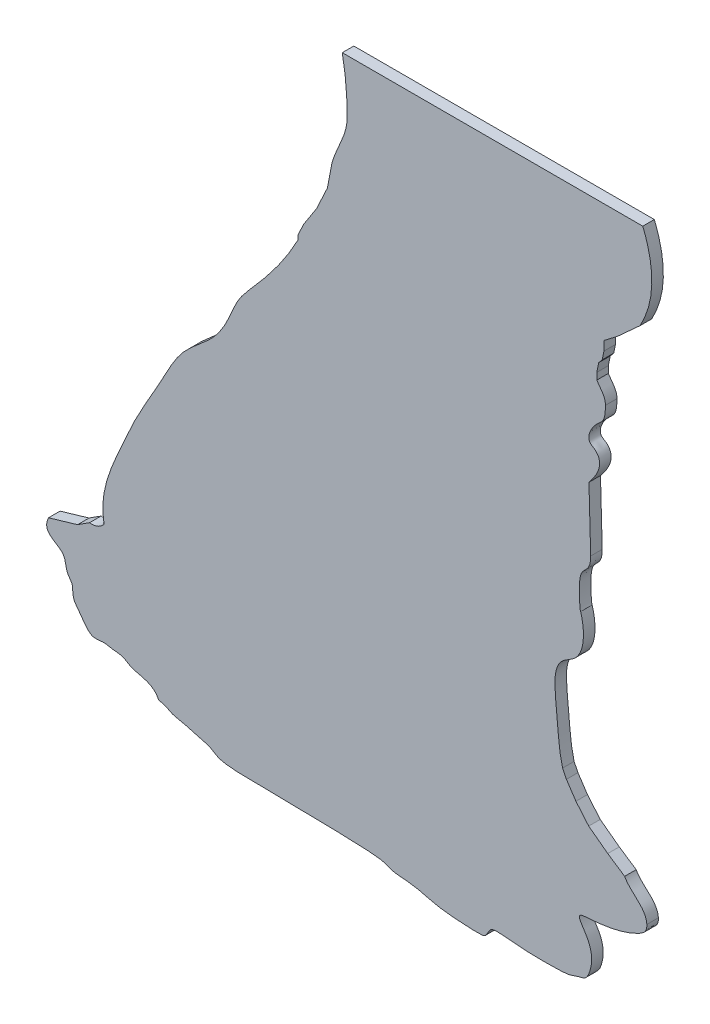
from build123d import *

# Parameters (mm, degrees)
BOSS_EXTRUDE2_DEPTH = 3.175


with BuildPart() as part:
    # Sketch1 → Boss-Extrude2 (new body)
    with BuildSketch(Plane.XY):
        with BuildLine():
            Line((167.202192931, 42.201207676), (162.551708352, 45.309526764))
            Line((162.551708352, 45.309526764), (157.314695785, 49.223337881))
            Line((157.314695785, 49.223337881), (153.792941224, 53.393644073))
            Line((153.792941224, 53.393644073), (151.178747268, 57.312700692))
            Line((151.178747268, 57.312700692), (150.112611404, 59.463302564))
            add(Edge.make_bspline(
                [(150.112611404, 59.463302564), (148.956776361, 63.836980097), (148.948583694, 71.439405876), (146.850507307, 84.051422667), (156.469353715, 88.150203705), (156.247504434, 95.51023866), (155.085269681, 99.2555556)],
                knots=[0, 0, 0, 0, 0.30878338, 0.618237109, 0.70440559, 1, 1, 1, 1], degree=3))
            add(Edge.make_bspline(
                [(157.85398611, 113.880538491), (157.856396998, 113.869859914), (157.850620297, 110.688002063), (155.308060719, 109.384630599), (154.418838948, 105.053269567), (154.8695522, 99.483416676), (155.085269681, 99.2555556)],
                knots=[0, 0, 0, 0, 0.124798805, 0.365607846, 0.555267038, 1, 1, 1, 1], degree=3))
            Line((157.85398611, 113.880538491), (157.37548461, 131.229540091))
            add(Edge.make_bspline(
                [(161.892659898, 151.807216677), (161.91251897, 149.031337188), (161.449944322, 147.791607901), (158.445100345, 145.385958906), (156.130886371, 141.380315264), (158.830222147, 140.043511959), (161.648730322, 137.407909117), (159.459654716, 133.727674066), (157.37548461, 131.229540091)],
                knots=[0, 0, 0, 0, 0.190659477, 0.228612673, 0.488802546, 0.534056192, 0.585175937, 1, 1, 1, 1], degree=3))
            add(Edge.make_bspline(
                [(159.534362736, 156.659486678), (160.786697559, 154.839870961), (162.005548182, 153.612430632), (161.892659898, 151.807216677)],
                knots=[0, 0, 0, 0, 1, 1, 1, 1], degree=3))
            Line((159.534362736, 156.659486678), (159.534362736, 158.498026385))
            Line((159.534362736, 158.498026385), (160.082455849, 161.112276627))
            Line((160.082455849, 161.112276627), (161.024283069, 162.24246929))
            Line((161.024283069, 162.24246929), (161.51276424, 164.572387305))
            Line((161.51276424, 164.572387305), (161.51276424, 167.102297744))
            Line((161.51276424, 167.102297744), (165.183542032, 169.901250177))
            Line((165.183542032, 169.901250177), (171.472031107, 175.621746691))
            add(Edge.make_bspline(
                [(172.196352762, 199.687728108), (177.512545782, 186.611864968), (171.472031107, 175.621746691)],
                knots=[0, 0, 0, 1, 1, 1], degree=2))
            Line((172.196352762, 199.687728108), (89.47301913, 199.687728108))
            add(Edge.make_bspline(
                [(89.47301913, 199.687728108), (90.449698127, 194.83749072), (90.825955315, 189.837761557), (90.838257386, 180.280743918), (87.678298822, 176.191377166), (86.590775441, 171.767770411)],
                knots=[0, 0, 0, 0, 0.517811069, 0.520823107, 1, 1, 1, 1], degree=3))
            Line((86.590775441, 171.767770411), (85.388246292, 165.381063893))
            Line((85.388246292, 165.381063893), (82.402306125, 158.982620678))
            Line((82.402306125, 158.982620678), (78.826589302, 153.432528352))
            Line((78.826589302, 153.432528352), (77.30963174, 150.181905003))
            Line((77.30963174, 150.181905003), (77.30963174, 148.972997238))
            add(Edge.make_bspline(
                [(23.904060298, 54.499744977), (22.54196001, 62.044422938), (27.151157223, 71.719882884), (33.171565612, 85.673583344), (39.470341202, 95.744406946), (45.044436084, 107.397118431), (54.154773918, 113.07293548), (58.357878564, 120.674742163), (60.641830631, 126.791490456), (68.416588167, 135.274765788), (73.920776574, 142.489426767), (77.30963174, 148.972997238)],
                knots=[0, 0, 0, 0, 0.194457475, 0.285904466, 0.412663627, 0.517827397, 0.629268786, 0.691338637, 0.750377013, 0.804905464, 1, 1, 1, 1], degree=3))
            add(Edge.make_bspline(
                [(19.90471503, 52.852955749), (22.437142387, 52.608313662), (23.904060298, 54.499744977)],
                knots=[0, 0, 0, 1, 1, 1], degree=2))
            Line((19.90471503, 52.852955749), (16.611136574, 50.735655313))
            Line((16.611136574, 50.735655313), (8.612446038, 48.383099273))
            add(Edge.make_bspline(
                [(8.612446038, 48.383099273), (6.569110394, 43.962826835), (13.647787757, 43.729648821), (13.25353988, 37.991488936), (15.22587651, 36.112808324), (15.244510931, 34.207409749), (15.425694449, 32.409220236), (16.98119857, 30.317149701), (18.454955258, 28.208570124), (20.727276999, 25.608877763), (23.640354073, 26.519579017), (26.378802415, 25.704997487), (29.007712932, 25.794951803), (31.225977748, 24.007852384), (34.946801718, 23.349304233), (38.00066538, 22.222153794), (38.883062856, 20.144990847)],
                knots=[0, 0, 0, 0, 0.185719976, 0.273851295, 0.320038418, 0.350192261, 0.393849297, 0.435550567, 0.514834292, 0.569194905, 0.638873602, 0.687586559, 0.755837415, 0.80106818, 0.86555143, 1, 1, 1, 1], degree=3))
            add(Edge.make_bspline(
                [(38.883062856, 20.144990847), (41.287485761, 19.565633761), (42.345781106, 18.507338416), (45.419877108, 18.154573301), (49.753848521, 16.793907858), (52.777549507, 16.18916766), (54.793350164, 14.828502217), (56.355595674, 14.173367003), (60.135221906, 13.770206872), (61.546282366, 13.770206872), (99.241754657, 13.215861691), (101.285601848, 12.223202762), (103.959367113, 11.297668631), (106.324621001, 11.297668631), (111.569314404, 10.577808752), (115.168613799, 9.24092612), (123.909769472, 8.521066241), (128.023254495, 8.521066241), (128.948788625, 8.726740492), (129.97715988, 10.783483004), (131.005531136, 11.811854259), (139.335338307, 10.783483004), (144.785705962, 10.783483004), (151.984304751, 10.783483004), (154.349558639, 12.120365636), (156.714812527, 12.120365636), (158.154532285, 16.028176407), (158.154532285, 19.318964425), (157.331835281, 21.684218313), (156.40630115, 23.329612322), (153.732535886, 27.134585968), (157.318908473, 27.134585968), (163.062883757, 27.775503981), (167.439245879, 28.924299038), (170.393290311, 30.100446358), (172.444710055, 31.285711099), (173.20373536, 32.322817748), (173.319982479, 33.191252106), (173.319982479, 33.793001898)],
                knots=[0, 0, 0, 0, 0.028571429, 0.057142857, 0.085714286, 0.114285714, 0.142857143, 0.171428571, 0.2, 0.228571429, 0.257142857, 0.285714286, 0.314285714, 0.342857143, 0.371428571, 0.4, 0.428571429, 0.457142857, 0.485714286, 0.514285714, 0.542857143, 0.571428571, 0.6, 0.628571429, 0.657142857, 0.685714286, 0.714285714, 0.742857143, 0.771428571, 0.8, 0.828571429, 0.857142857, 0.885714286, 0.914285714, 0.942857143, 0.971428571, 0.985714286, 1, 1, 1, 1], degree=3))
            add(Edge.make_bspline(
                [(173.319982479, 33.793001898), (173.056351571, 37.626592871), (168.840626644, 39.112234918), (167.202192931, 42.201207676)],
                knots=[0, 0, 0, 0, 1, 1, 1, 1], degree=3))
        make_face()
    extrude(amount=BOSS_EXTRUDE2_DEPTH)


solid = part.part
